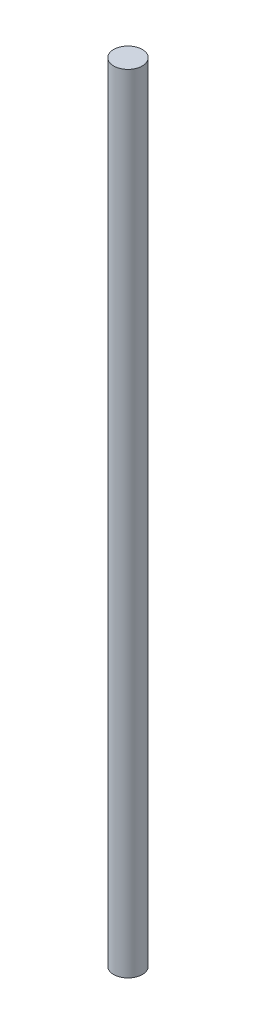
from build123d import *

# Parameters (mm, degrees)
SKETCH3_R           = 5.005
BOSS_EXTRUDE1_DEPTH = 275


with BuildPart() as part:
    # Sketch3 → Boss-Extrude1 (new body)
    with BuildSketch(Plane(origin=(0, 0, 0), x_dir=(1, 0, 0), z_dir=(0, 1, 0))):
        with Locations(Location((0, 0, 0), (0, 0, 270))):
            Circle(SKETCH3_R)
    extrude(amount=BOSS_EXTRUDE1_DEPTH)


solid = part.part
